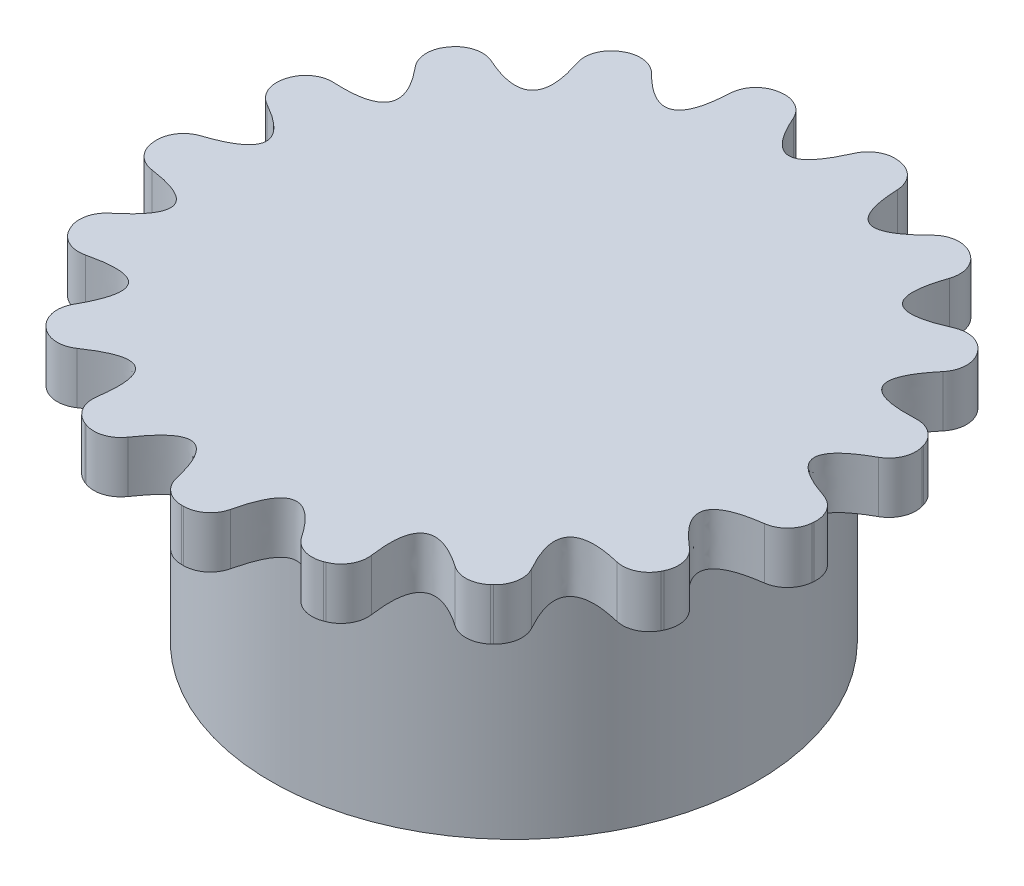
from build123d import *

# Parameters (mm, degrees)
SKETCH1_R                = 13.7922
BOSS_EXTRUDE1_DEPTH      = 13.1318
SKETCH2_R                = 18.796
BOSS_EXTRUDE2_DEPTH      = 2.921
CUT_EXTRUDE1_START       = -2.921
CUT_EXTRUDE1_DEPTH       = 34.973723227
FILLET1_R                = 1.524
CIRPATTERN1_COUNT        = 17
FILLET1_OF_CIRPATTERN1_R = 1.524


with BuildPart() as part:
    # Sketch1 → Boss-Extrude1 (new body)
    with BuildSketch(Plane(origin=(0, 0, 0), x_dir=(1, 0, 0), z_dir=(0, 1, 0))):
        with Locations(Location((0, 0, 0), (0, 0, 90))):
            Circle(SKETCH1_R)
    extrude(amount=BOSS_EXTRUDE1_DEPTH)

    # Sketch2 → Boss-Extrude2 (add)
    with BuildSketch(Plane(origin=(0, 13.1318, 0), x_dir=(1, 0, 0), z_dir=(0, 1, 0))):
        with Locations(Location((0, 0, 0), (0, 0, 270))):
            Circle(SKETCH2_R)
    extrude(amount=BOSS_EXTRUDE2_DEPTH)

    # Sketch3 → Cut-Extrude1 (cut)
    with BuildSketch(Plane(origin=(0, 16.0528, 0), x_dir=(1, 0, 0), z_dir=(0, 1, 0)).offset(CUT_EXTRUDE1_START)):
        with BuildLine():
            add(Edge.make_bspline(
                [(2.149801102, 18.672653031), (-0.001562816, 12.568942941), (-2.142798898, 18.673457872)],
                knots=[0, 0, 0, 1, 1, 1], degree=2))
            ThreePointArc((2.149801102, 18.672653031), (0.003524154, 18.79599967), (-2.142798898, 18.673457872))
        make_face()
    cut_extrude1 = extrude(amount=CUT_EXTRUDE1_DEPTH, mode=Mode.SUBTRACT)

    # Fillet1
    fillet1_edges = [part.edges().sort_by_distance(p)[0] for p in [
        (2.149801102, 14.5923, -18.672653031),
        (-2.142798898, 14.5923, -18.673457872),
    ]]
    fillet(fillet1_edges, radius=FILLET1_R)

    # CirPattern1: Cut-Extrude1 ×17 about axis
    cirpattern1_axis = Axis((0, 16.0528, 0), (0, 1, 0))
    for i in range(1, CIRPATTERN1_COUNT):
        add(cut_extrude1.rotate(cirpattern1_axis, i * 360 / CIRPATTERN1_COUNT), mode=Mode.SUBTRACT)

    # Fillet1 of CirPattern1
    fillet1_of_cirpattern1_edges = [part.edges().sort_by_distance(p)[0] for p in [
        (-4.740710467, 14.5923, -18.188328133),
        (-8.7437315, 14.5923, -16.638412648),
        (-10.990962818, 14.5923, -15.247568735),
        (-14.163774713, 14.5923, -12.3562576),
        (-15.756824737, 14.5923, -10.24754069),
        (-17.670921667, 14.5923, -6.405321494),
        (-18.394640164, 14.5923, -3.863525492),
        (-18.791512731, 14.5923, 0.410688772),
        (-18.548157509, 14.5923, 3.042280233),
        (-17.374205874, 14.5923, 7.171233244),
        (-16.196643403, 14.5923, 9.537209155),
        (-13.61041624, 14.5923, 12.96326293),
        (-11.657682857, 14.5923, 14.744085133),
        (-8.008464474, 14.5923, 17.004532124),
        (-5.544287644, 14.5923, 17.959690713),
        (-1.324925205, 14.5923, 18.74924503),
        (1.317894338, 14.5923, 18.749740545),
        (5.537552555, 14.5923, 17.961768502),
        (8.002087386, 14.5923, 17.007534021),
        (11.652153157, 14.5923, 14.748455607),
        (13.605554192, 14.5923, 12.968365784),
        (16.193065909, 14.5923, 9.543282059),
        (17.371515514, 14.5923, 7.177747889),
        (18.547015381, 14.5923, 3.049235388),
        (18.791357406, 14.5923, 0.417735368),
        (18.396087653, 14.5923, -3.856627419),
        (17.673322354, 14.5923, -6.39869463),
        (15.760666352, 14.5923, -10.241631323),
        (14.168407187, 14.5923, -12.350945461),
        (10.996679727, 14.5923, -15.243446165),
        (8.74997012, 14.5923, -16.635132669),
        (4.74753057, 14.5923, -18.186549136),
    ]]
    fillet(fillet1_of_cirpattern1_edges, radius=FILLET1_OF_CIRPATTERN1_R)


solid = part.part
